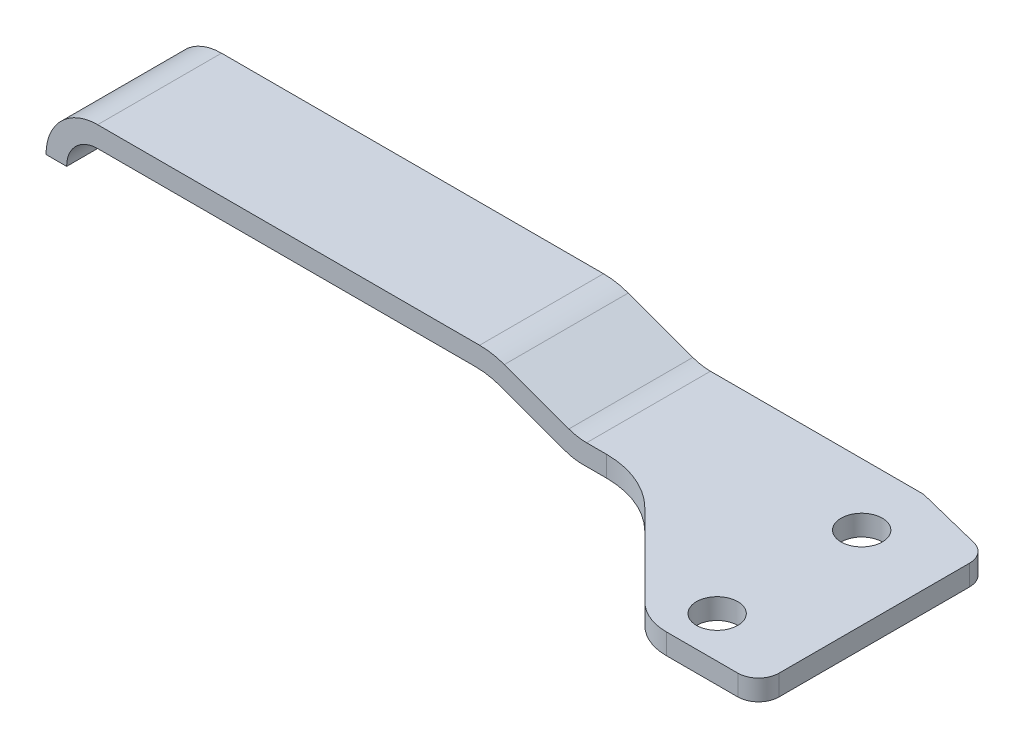
from build123d import *

# Parameters (mm, degrees)
SKETCH2_W               = 128.6002
SKETCH2_H               = 38.1
BOSS_EXTRUDE1_DEPTH     = 7.9375
CUT_EXTRUDE1_DEPTH      = 7.9375
CUT_EXTRUDE3_DEPTH      = 7.9375
FILLET3_R               = 3.175
SKETCH6_R               = 3.175
CUT_EXTRUDE4_DEPTH      = 7.9375
CUT_EXTRUDE8_DEPTH      = 76.160606479
CUT_EXTRUDE8_DEPTH_BACK = 76.160606479
SKETCH12_W              = 13.089840981
SKETCH12_H              = 4.7625


with BuildPart() as part:
    # Sketch2 → Boss-Extrude1 (new body)
    with BuildSketch(Plane(origin=(0, 0, 0), x_dir=(1, 0, 0), z_dir=(0, 1, 0))):
        Rectangle(SKETCH2_W, SKETCH2_H)
    extrude(amount=BOSS_EXTRUDE1_DEPTH)

    # Sketch4 → Cut-Extrude1 (cut)
    with BuildSketch(Plane(origin=(0, 7.9375, 0), x_dir=(1, 0, 0), z_dir=(0, 1, 0))):
        Polygon((64.3001, 19.05), (51.6001, 19.05), (64.3001, 15.883534364), align=None)
    extrude(amount=-CUT_EXTRUDE1_DEPTH, mode=Mode.SUBTRACT)

    # Sketch5 → Cut-Extrude3 (cut)
    with BuildSketch(Plane(origin=(0, 7.9375, 0), x_dir=(1, 0, 0), z_dir=(0, 1, 0))):
        with BuildLine():
            Line((-64.3001, 0), (21.860482552, 0))
            ThreePointArc((21.860482552, 0), (27.332932171, -1.088537909), (31.972250944, -4.188431608))
            Line((31.972250944, -4.188431608), (44.505259668, -16.721440332))
            ThreePointArc((44.505259668, -16.721440332), (47.084490176, -18.444827059), (50.1269, -19.05))
            Line((50.1269, -19.05), (-64.3001, -19.05))
            Line((-64.3001, -19.05), (-64.3001, 0))
        make_face()
    extrude(amount=-CUT_EXTRUDE3_DEPTH, mode=Mode.SUBTRACT)

    # Fillet3
    fillet3_edges = [part.edges().sort_by_distance(p)[0] for p in [
        (64.3001, 3.96875, -15.883534364),
        (51.6001, 3.96875, -19.05),
        (64.3001, 3.96875, 19.05),
    ]]
    fillet(fillet3_edges, radius=FILLET3_R)

    # Sketch6 → Cut-Extrude4 (cut)
    with BuildSketch(Plane(origin=(0, 7.9375, 0), x_dir=(1, 0, 0), z_dir=(0, 1, 0))):
        with Locations(Location((51.6001, 9.525, 0), (0, 0, 270))):
            Circle(SKETCH6_R)
        with Locations(Location((51.6001, -12.7, 0), (0, 0, 270))):
            Circle(SKETCH6_R)
    extrude(amount=-CUT_EXTRUDE4_DEPTH, mode=Mode.SUBTRACT)

    # Sketch12 → Cut-Extrude8 (cut, two sides: drawn at the far end of the back side and taken through both)
    with BuildSketch(Plane(origin=(0, 0, -19.05), x_dir=(-1, 0, 0), z_dir=(0, 0, -1)).offset(-CUT_EXTRUDE8_DEPTH_BACK)):
        with BuildLine():
            Line((-10.637677607, 5.644085453), (-6.179942499, 7.266568345))
            ThreePointArc((-6.179942499, 7.266568345), (-4.306770706, 7.768483214), (-2.3749, 7.9375))
            Line((-2.3749, 7.9375), (-51.210259019, 7.9375))
            Line((-51.210259019, 7.9375), (-51.210259019, 3.175))
            Line((-51.210259019, 3.175), (-24.615767874, 3.175))
            Line((-24.615767874, 3.175), (-18.823268898, 3.175))
            ThreePointArc((-18.823268898, 3.175), (-17.442731156, 3.295781402), (-16.104140354, 3.654455726))
            Line((-16.104140354, 3.654455726), (-10.637677607, 5.644085453))
        make_face()
        with Locations((-57.75517951, 5.55625)):
            Rectangle(SKETCH12_W, SKETCH12_H)
        with BuildLine():
            ThreePointArc((56.3626, 7.9375), (61.975260076, 5.612660076), (64.3001, 0))
            Line((64.3001, 0), (64.3001, 7.9375))
            Line((64.3001, 7.9375), (56.3626, 7.9375))
        make_face()
        with BuildLine():
            ThreePointArc((61.1251, 0), (59.730196045, 3.367596045), (56.3626, 4.7625))
            Line((56.3626, 4.7625), (-1.766638139, 4.7625))
            ThreePointArc((-1.766638139, 4.7625), (-3.698508845, 4.593483214), (-5.571680637, 4.091568345))
            Line((-5.571680637, 4.091568345), (-12.417211155, 1.599998998))
            Line((-12.417211155, 1.599998998), (-15.530771457, 0.466755726))
            ThreePointArc((-15.530771457, 0.466755726), (-16.648641249, 0.150225095), (-17.800707625, 0))
            Line((-17.800707625, 0), (48.4251, 0))
            Line((48.4251, 0), (51.6001, 0))
            Line((51.6001, 0), (61.1251, 0))
        make_face()
    extrude(amount=CUT_EXTRUDE8_DEPTH + CUT_EXTRUDE8_DEPTH_BACK, mode=Mode.SUBTRACT)


solid = part.part
